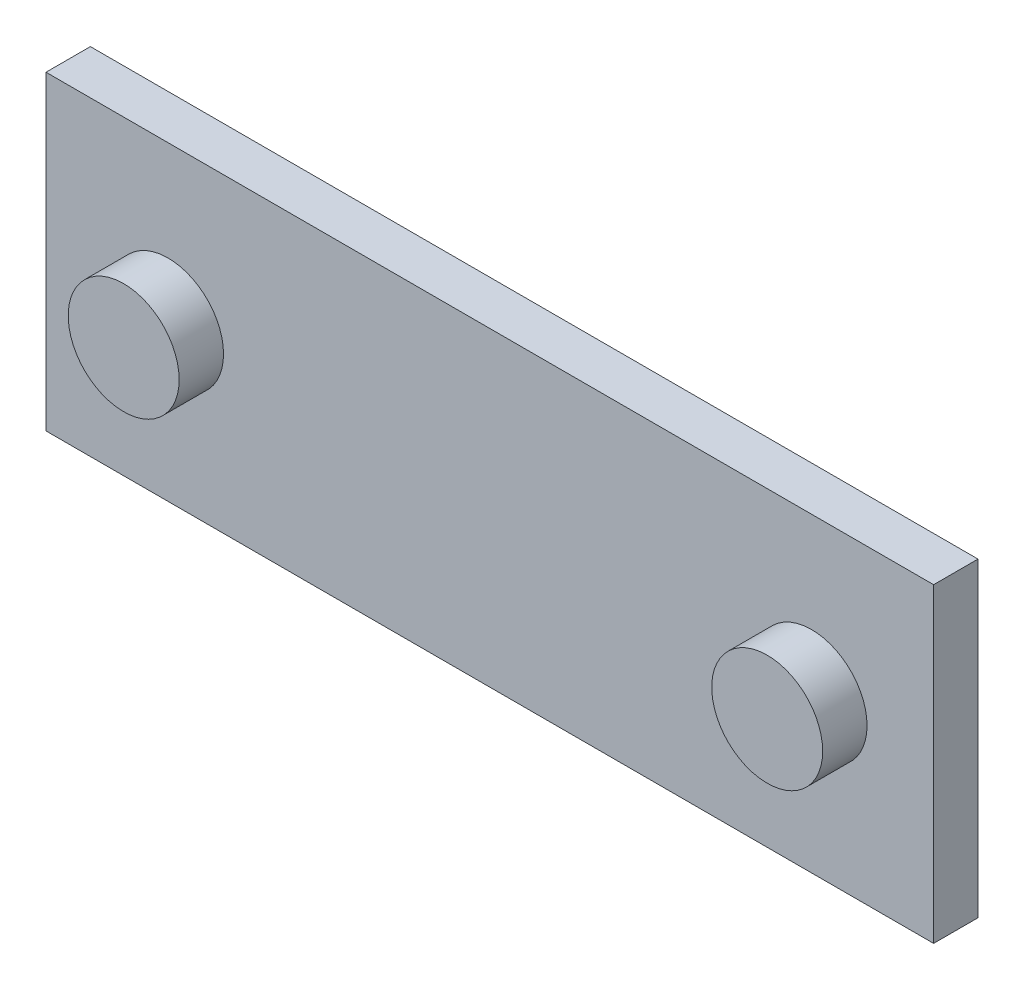
from build123d import *

# Parameters (mm, degrees)
SKETCH1_W           = 20
SKETCH1_H           = 7
BOSS_EXTRUDE1_DEPTH = 1
SKETCH2_R           = 1.25
BOSS_EXTRUDE2_DEPTH = 1


with BuildPart() as part:
    # Sketch1 → Boss-Extrude1 (new body)
    with BuildSketch(Plane.XY):
        Rectangle(SKETCH1_W, SKETCH1_H)
    extrude(amount=BOSS_EXTRUDE1_DEPTH)

    # Sketch2 → Boss-Extrude2 (add)
    with BuildSketch(Plane.XY.offset(1)):
        with Locations((-7.25, 0)):
            Circle(SKETCH2_R)
        with Locations((7.25, 0)):
            Circle(SKETCH2_R)
    extrude(amount=BOSS_EXTRUDE2_DEPTH)


solid = part.part
